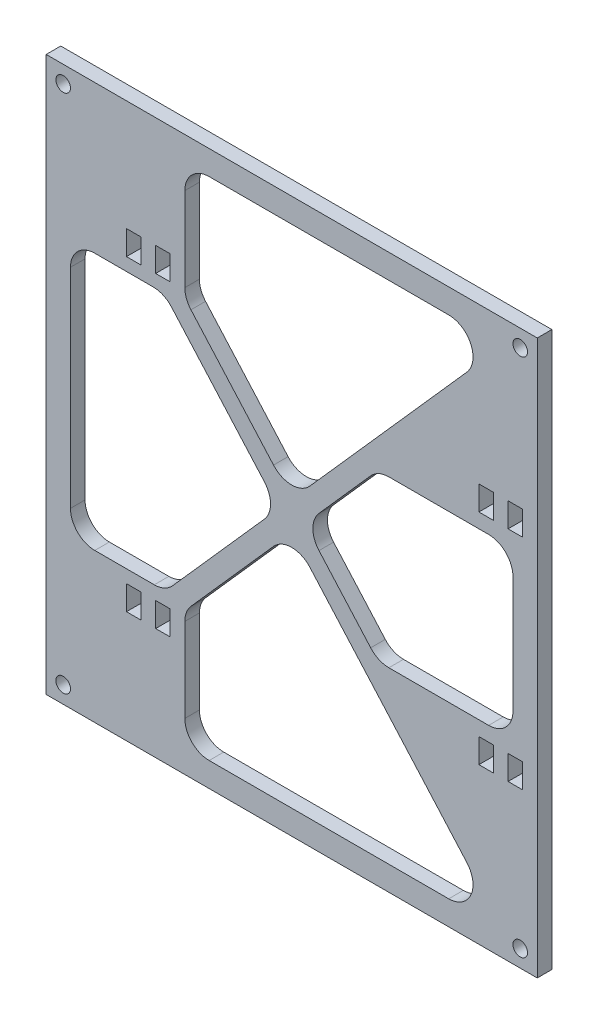
from build123d import *

# Parameters (mm, degrees)
SKETCH1_R           = 1.5
BOSS_EXTRUDE1_DEPTH = 3
SKETCH2_W           = 3
SKETCH2_H           = 5
BOSS_EXTRUDE2_DEPTH = 3
SKETCH2_2_W         = 3
SKETCH2_2_H         = 5
SKETCH2_2_W_2       = 2
CUT_EXTRUDE1_DEPTH  = 3
SKETCH3_W           = 3
SKETCH3_H           = 5
BOSS_EXTRUDE3_DEPTH = 3
SKETCH3_2_W         = 3
SKETCH3_2_H         = 5
CUT_EXTRUDE2_DEPTH  = 3
FILLET4_R           = 5


with BuildPart() as part:
    # Sketch1 → Boss-Extrude1 (new body)
    with BuildSketch(Plane.XY):
        Polygon((71.686424942, 53.861993355), (71.686424942, 56.877946104), (69.01439663, 56.877946104), (-29.313575058, 56.877946104), (-29.313575058, -54.106101147), (-29.313575058, -57.122053896), (-26.641546745, -57.122053896), (69.01439663, -57.122053896), (71.686424942, -57.122053896), (71.686424942, -54.106101147), align=None)
        with Locations((-25.813575058, -53.622053896)):
            Circle(SKETCH1_R, mode=Mode.SUBTRACT)
        with BuildLine():
            Line((53.474676725, -52.122053896), (-11.101826841, -52.122053896))
            ThreePointArc((-11.101826841, -52.122053896), (-15.66135034, -49.174063999), (-14.844302156, -43.806352082))
            Line((-14.844302156, -43.806352082), (17.443949627, -7.362186703))
            ThreePointArc((17.443949627, -7.362186703), (21.186424942, -5.677888517), (24.928900257, -7.362186703))
            Line((24.928900257, -7.362186703), (57.21715204, -43.806352082))
            ThreePointArc((57.21715204, -43.806352082), (58.034200224, -49.174063999), (53.474676725, -52.122053896))
        make_face(mode=Mode.SUBTRACT)
        with Locations((68.186424942, -53.622053896)):
            Circle(SKETCH1_R, mode=Mode.SUBTRACT)
        with BuildLine():
            ThreePointArc((-15.571099743, -38.594792376), (-21.086654783, -39.954150806), (-24.313575058, -35.279090562))
            Line((-24.313575058, -35.279090562), (-24.313575058, 35.03498277))
            ThreePointArc((-24.313575058, 35.03498277), (-21.086654783, 39.710043015), (-15.571099743, 38.350684584))
            Line((-15.571099743, 38.350684584), (15.576801163, 3.193647918))
            ThreePointArc((15.576801163, 3.193647918), (16.834325848, -0.122053896), (15.576801163, -3.43775571))
            Line((15.576801163, -3.43775571), (-15.571099743, -38.594792376))
        make_face(mode=Mode.SUBTRACT)
        with Locations((-25.813575058, 53.377946104)):
            Circle(SKETCH1_R, mode=Mode.SUBTRACT)
        with BuildLine():
            Line((66.686424942, 35.03498277), (66.686424942, -35.279090562))
            ThreePointArc((66.686424942, -35.279090562), (63.459504668, -39.954150806), (57.943949627, -38.594792376))
            Line((57.943949627, -38.594792376), (26.796048721, -3.43775571))
            ThreePointArc((26.796048721, -3.43775571), (25.538524036, -0.122053896), (26.796048721, 3.193647918))
            Line((26.796048721, 3.193647918), (57.943949627, 38.350684584))
            ThreePointArc((57.943949627, 38.350684584), (63.459504668, 39.710043015), (66.686424942, 35.03498277))
        make_face(mode=Mode.SUBTRACT)
        with BuildLine():
            ThreePointArc((-14.844302156, 43.56224429), (-15.66135034, 48.929956208), (-11.101826841, 51.877946104))
            Line((-11.101826841, 51.877946104), (53.474676725, 51.877946104))
            ThreePointArc((53.474676725, 51.877946104), (58.034200224, 48.929956208), (57.21715204, 43.56224429))
            Line((57.21715204, 43.56224429), (24.928900257, 7.118078911))
            ThreePointArc((24.928900257, 7.118078911), (21.186424942, 5.433780725), (17.443949627, 7.118078911))
            Line((17.443949627, 7.118078911), (-14.844302156, 43.56224429))
        make_face(mode=Mode.SUBTRACT)
        with Locations((68.186424942, 53.377946104)):
            Circle(SKETCH1_R, mode=Mode.SUBTRACT)
    extrude(amount=BOSS_EXTRUDE1_DEPTH)

    # Sketch2 → Boss-Extrude2 (add)
    # profile 1 of 2: a face of its own
    with BuildSketch(Plane.XY.offset(3)):
        Polygon((69.525635116, 16.877946104), (38.919856763, 16.877946104), (69.525635116, 52.236469223), align=None)
        with Locations((67.186424942, 22.377946104)):
            Rectangle(SKETCH2_W, SKETCH2_H, mode=Mode.SUBTRACT)
        with Locations((61.186424942, 22.377946104)):
            Rectangle(SKETCH2_W, SKETCH2_H, mode=Mode.SUBTRACT)
    # profile 2 of 2: a face of its own
    with BuildSketch(Plane.XY.offset(3)):
        Polygon((69.539183497, -17.122053896), (38.919856763, -17.122053896), (69.539183497, -51.682482091), align=None)
        with Locations((67.186424942, -22.622053896)):
            Rectangle(SKETCH2_W, SKETCH2_H, mode=Mode.SUBTRACT)
        with Locations((61.186424942, -22.622053896)):
            Rectangle(SKETCH2_W, SKETCH2_H, mode=Mode.SUBTRACT)
    extrude(amount=-BOSS_EXTRUDE2_DEPTH)

    # Sketch2<2> → Cut-Extrude1 (cut)
    with BuildSketch(Plane.XY.offset(3)):
        with Locations((67.186424942, -22.622053896)):
            Rectangle(SKETCH2_2_W, SKETCH2_2_H)
        with Locations((67.686424942, 22.377946104)):
            Rectangle(SKETCH2_2_W_2, SKETCH2_2_H)
    extrude(amount=-CUT_EXTRUDE1_DEPTH, mode=Mode.SUBTRACT)

    # Sketch3 → Boss-Extrude3 (add)
    with BuildSketch(Plane.XY.offset(3)):
        Polygon((-0.794496608, -27.948155721), (-0.794496608, -52.122053896), (-24.313575058, -52.122053896), (-24.313575058, -26.468030189), (-0.794496608, -26.468030189), align=None)
        with Locations((-11.294496608, -31.622053896)):
            Rectangle(SKETCH3_W, SKETCH3_H, mode=Mode.SUBTRACT)
        with Locations((-5.294496608, -31.622053896)):
            Rectangle(SKETCH3_W, SKETCH3_H, mode=Mode.SUBTRACT)
    boss_extrude3 = extrude(amount=-BOSS_EXTRUDE3_DEPTH)

    # Sketch3<2> → Cut-Extrude2 (cut)
    with BuildSketch(Plane.XY.offset(3)):
        with Locations((-11.294496608, -31.622053896)):
            Rectangle(SKETCH3_2_W, SKETCH3_2_H)
        with Locations((-5.294496608, -31.622053896)):
            Rectangle(SKETCH3_2_W, SKETCH3_2_H)
    cut_extrude2 = extrude(amount=-CUT_EXTRUDE2_DEPTH, mode=Mode.SUBTRACT)

    # Mirror1: Boss-Extrude3, Cut-Extrude2 across plane
    add(boss_extrude3.mirror(Plane.ZX))
    add(cut_extrude2.mirror(Plane.ZX), mode=Mode.SUBTRACT)

    # Fillet4
    fillet4_edges = [part.edges().sort_by_distance(p)[0] for p in [
        (-4.827213946, -26.468030189, 1.5),
        (-24.313575058, -26.468030189, 1.5),
        (-0.794496608, -52.122053896, 1.5),
        (-0.794496608, -27.948155721, 1.5),
        (-0.794496608, 51.877946104, 1.5),
        (-0.794496608, 27.70404793, 1.5),
        (-24.313575058, 26.468030189, 1.5),
        (-5.043484884, 26.468030189, 1.5),
        (38.919856763, 16.877946104, 1.5),
        (66.686424942, 16.877946104, 1.5),
        (66.686424942, -17.122053896, 1.5),
        (38.919856763, -17.122053896, 1.5),
    ]]
    fillet(fillet4_edges, radius=FILLET4_R)


solid = part.part
